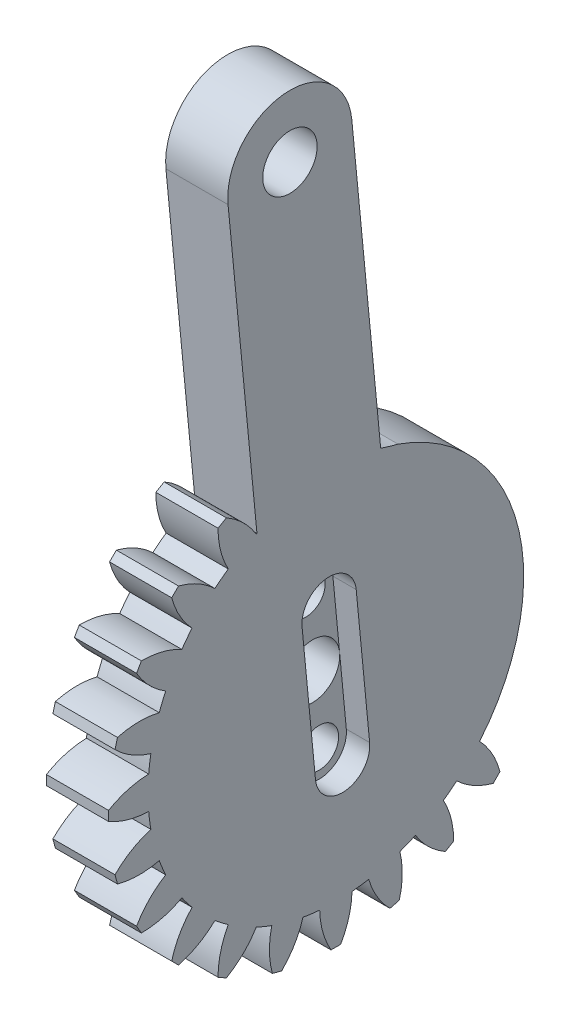
from build123d import *

# Parameters (mm, degrees)
SKETCH1_R           = 1.75
BOSS_EXTRUDE1_DEPTH = 4
SKETCH3_R           = 1.25
CUT_EXTRUDE1_DEPTH  = 38.785297658
CUT_EXTRUDE2_START  = -4
CUT_EXTRUDE2_DEPTH  = 1.5


with BuildPart() as part:
    # Sketch1 → Boss-Extrude1 (new body)
    with BuildSketch(Plane.YZ):
        with BuildLine():
            Line((0.31, 14.63), (-0.31, 14.63))
            ThreePointArc((-0.31, 14.63), (-0.838273314, 13.383704325), (-1.04, 12.04518576))
            ThreePointArc((-1.04, 12.04518576), (-1.578061664, 11.986568374), (-2.112960617, 11.903927815))
            ThreePointArc((-2.112960617, 11.903927815), (-2.65424773, 13.144626757), (-3.487085624, 14.211728743))
            Line((-3.487085624, 14.211728743), (-4.085959636, 14.051260935))
            ThreePointArc((-4.085959636, 14.051260935), (-4.273667417, 12.71070456), (-4.122086336, 11.365584201))
            ThreePointArc((-4.122086336, 11.365584201), (-4.626642697, 11.169703548), (-5.12192646, 10.951436862))
            ThreePointArc((-5.12192646, 10.951436862), (-5.965886177, 12.009764599), (-7.046532125, 12.824951657))
            Line((-7.046532125, 12.824951657), (-7.583467875, 12.514951657))
            ThreePointArc((-7.583467875, 12.514951657), (-7.417818147, 11.171491285), (-6.9232593, 9.911436862))
            ThreePointArc((-6.9232593, 9.911436862), (-7.359925677, 9.591641884), (-7.781841479, 9.252623584))
            ThreePointArc((-7.781841479, 9.252623584), (-8.870959341, 10.05645683), (-10.125769107, 10.564175311))
            Line((-10.125769107, 10.564175311), (-10.564175311, 10.125769107))
            ThreePointArc((-10.564175311, 10.125769107), (-10.05645683, 8.870959341), (-9.252623584, 7.781841479))
            ThreePointArc((-9.252623584, 7.781841479), (-9.591641884, 7.359925677), (-9.911436862, 6.9232593))
            ThreePointArc((-9.911436862, 6.9232593), (-11.171491285, 7.417818147), (-12.514951657, 7.583467875))
            Line((-12.514951657, 7.583467875), (-12.824951657, 7.046532125))
            ThreePointArc((-12.824951657, 7.046532125), (-12.009764599, 5.965886177), (-10.951436862, 5.12192646))
            ThreePointArc((-10.951436862, 5.12192646), (-11.169703548, 4.626642697), (-11.365584201, 4.122086336))
            ThreePointArc((-11.365584201, 4.122086336), (-12.71070456, 4.273667417), (-14.051260935, 4.085959636))
            Line((-14.051260935, 4.085959636), (-14.211728743, 3.487085624))
            ThreePointArc((-14.211728743, 3.487085624), (-13.144626757, 2.65424773), (-11.903927815, 2.112960617))
            ThreePointArc((-11.903927815, 2.112960617), (-11.986568374, 1.578061664), (-12.04518576, 1.04))
            ThreePointArc((-12.04518576, 1.04), (-13.383704325, 0.838273314), (-14.63, 0.31))
            Line((-14.63, 0.31), (-14.63, -0.31))
            ThreePointArc((-14.63, -0.31), (-13.383704325, -0.838273314), (-12.04518576, -1.04))
            ThreePointArc((-12.04518576, -1.04), (-11.986568374, -1.578061664), (-11.903927815, -2.112960617))
            ThreePointArc((-11.903927815, -2.112960617), (-13.144626757, -2.65424773), (-14.211728743, -3.487085624))
            Line((-14.211728743, -3.487085624), (-14.051260935, -4.085959636))
            ThreePointArc((-14.051260935, -4.085959636), (-12.71070456, -4.273667417), (-11.365584201, -4.122086336))
            ThreePointArc((-11.365584201, -4.122086336), (-11.169703548, -4.626642697), (-10.951436862, -5.12192646))
            ThreePointArc((-10.951436862, -5.12192646), (-12.009764599, -5.965886177), (-12.824951657, -7.046532125))
            Line((-12.824951657, -7.046532125), (-12.514951657, -7.583467875))
            ThreePointArc((-12.514951657, -7.583467875), (-11.171491285, -7.417818147), (-9.911436862, -6.9232593))
            ThreePointArc((-9.911436862, -6.9232593), (-9.591641884, -7.359925677), (-9.252623584, -7.781841479))
            ThreePointArc((-9.252623584, -7.781841479), (-10.05645683, -8.870959341), (-10.564175311, -10.125769107))
            Line((-10.564175311, -10.125769107), (-10.125769107, -10.564175311))
            ThreePointArc((-10.125769107, -10.564175311), (-8.870959341, -10.05645683), (-7.781841479, -9.252623584))
            ThreePointArc((-7.781841479, -9.252623584), (3.191677838, -11.661101688), (11.409123542, -4))
            ThreePointArc((11.409123542, -4), (11.561502637, -3.438555035), (11.740713538, -2.885090229))
            Line((11.740713538, -2.885090229), (13.278503475, -2.736624135))
            Line((13.278503475, -2.736624135), (30.992077522, -1.026465229))
            ThreePointArc((30.992077522, -1.026465229), (34.589171795, 3.3394153), (30.223291266, 6.936509573))
            Line((30.223291266, 6.936509573), (10.971927281, 5.077884573))
            ThreePointArc((10.971927281, 5.077884573), (10.96170419, 5.099915807), (10.951436862, 5.12192646))
            ThreePointArc((10.951436862, 5.12192646), (12.009764599, 5.965886177), (12.824951657, 7.046532125))
            Line((12.824951657, 7.046532125), (12.514951657, 7.583467875))
            ThreePointArc((12.514951657, 7.583467875), (11.171491285, 7.417818147), (9.911436862, 6.9232593))
            ThreePointArc((9.911436862, 6.9232593), (9.591641884, 7.359925677), (9.252623584, 7.781841479))
            ThreePointArc((9.252623584, 7.781841479), (10.05645683, 8.870959341), (10.564175311, 10.125769107))
            Line((10.564175311, 10.125769107), (10.125769107, 10.564175311))
            ThreePointArc((10.125769107, 10.564175311), (8.870959341, 10.05645683), (7.781841479, 9.252623584))
            ThreePointArc((7.781841479, 9.252623584), (7.359925677, 9.591641884), (6.9232593, 9.911436862))
            ThreePointArc((6.9232593, 9.911436862), (7.417818147, 11.171491285), (7.583467875, 12.514951657))
            Line((7.583467875, 12.514951657), (7.046532125, 12.824951657))
            ThreePointArc((7.046532125, 12.824951657), (5.965886177, 12.009764599), (5.12192646, 10.951436862))
            ThreePointArc((5.12192646, 10.951436862), (4.626642697, 11.169703548), (4.122086336, 11.365584201))
            ThreePointArc((4.122086336, 11.365584201), (4.273667417, 12.71070456), (4.085959636, 14.051260935))
            Line((4.085959636, 14.051260935), (3.487085624, 14.211728743))
            ThreePointArc((3.487085624, 14.211728743), (2.65424773, 13.144626757), (2.112960617, 11.903927815))
            ThreePointArc((2.112960617, 11.903927815), (1.578061664, 11.986568374), (1.04, 12.04518576))
            ThreePointArc((1.04, 12.04518576), (0.838273314, 13.383704325), (0.31, 14.63))
        make_face()
        with Locations(Location((0, 0, 0), (0, 0, 270))):
            Circle(SKETCH1_R, mode=Mode.SUBTRACT)
        with Locations(Location((30.607684394, 2.955022172, 0), (0, 0, 270))):
            Circle(SKETCH1_R, mode=Mode.SUBTRACT)
    extrude(amount=BOSS_EXTRUDE1_DEPTH)

    # Sketch3 → Cut-Extrude1 (cut, through all)
    with BuildSketch(Plane(origin=(0, 0, 0), x_dir=(0, -1, 0), z_dir=(-1, 0, 0))):
        with Locations(Location((-4.479173326, 0.432442269, 0), (0, 0, 90))):
            Circle(SKETCH3_R)
        with Locations(Location((4.479173326, -0.432442269, 0), (0, 0, 270))):
            Circle(SKETCH3_R)
    extrude(amount=-CUT_EXTRUDE1_DEPTH, mode=Mode.SUBTRACT)

    # Sketch4 → Cut-Extrude2 (cut)
    with BuildSketch(Plane(origin=(0, 0, 0), x_dir=(0, -1, 0), z_dir=(-1, 0, 0)).offset(CUT_EXTRUDE2_START)):
        with BuildLine():
            ThreePointArc((6.229173326, -0.432442269), (5.774704296, 0.744035315), (4.647345319, 1.309458469))
            Line((4.647345319, 1.309458469), (4.311001332, -2.174343007))
            ThreePointArc((4.311001332, -2.174343007), (5.65565091, -1.727973239), (6.229173326, -0.432442269))
        make_face()
        with BuildLine():
            Line((4.311001332, -2.174343007), (4.647345319, 1.309458469))
            ThreePointArc((4.647345319, 1.309458469), (2.737272588, -0.264270276), (4.311001332, -2.174343007))
        make_face()
        with BuildLine():
            ThreePointArc((-2.729173326, 0.432442269), (-3.183642356, 1.608919853), (-4.311001332, 2.174343007))
            Line((-4.311001332, 2.174343007), (-4.647345319, -1.309458469))
            ThreePointArc((-4.647345319, -1.309458469), (-3.302695742, -0.863088701), (-2.729173326, 0.432442269))
        make_face()
        with BuildLine():
            Line((-4.647345319, -1.309458469), (-4.311001332, 2.174343007))
            ThreePointArc((-4.311001332, 2.174343007), (-6.221074064, 0.600614263), (-4.647345319, -1.309458469))
        make_face()
        with BuildLine():
            ThreePointArc((4.311001332, -2.174343007), (2.737272588, -0.264270276), (4.647345319, 1.309458469))
            Line((4.647345319, 1.309458469), (-4.311001332, 2.174343007))
            ThreePointArc((-4.311001332, 2.174343007), (-3.183642356, 1.608919853), (-2.729173326, 0.432442269))
            ThreePointArc((-2.729173326, 0.432442269), (-3.302695742, -0.863088701), (-4.647345319, -1.309458469))
            Line((-4.647345319, -1.309458469), (4.311001332, -2.174343007))
        make_face()
    extrude(amount=CUT_EXTRUDE2_DEPTH, mode=Mode.SUBTRACT)


solid = part.part
